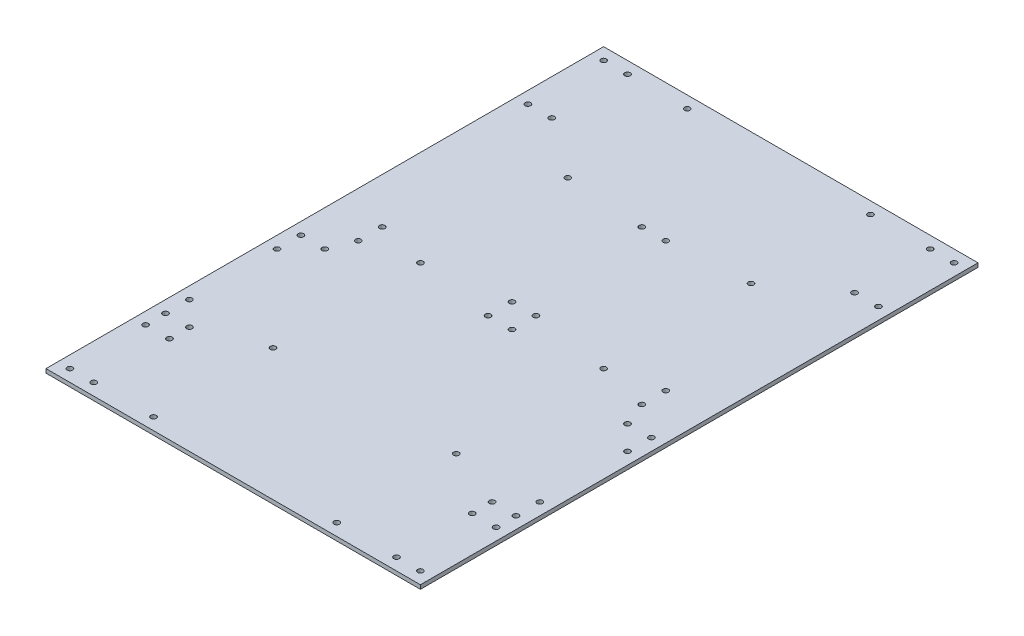
from build123d import *

# Parameters (mm, degrees)
SKETCH1_W           = 596.9
SKETCH1_H           = 889
SKETCH1_R           = 4.365625
BOSS_EXTRUDE1_DEPTH = 6.35


with BuildPart() as part:
    # Sketch1 → Boss-Extrude1 (new body)
    with BuildSketch(Plane(origin=(0, 0, 0), x_dir=(1, 0, 0), z_dir=(0, 1, 0))):
        with Locations((298.45, 514.143037509)):
            Rectangle(SKETCH1_W, SKETCH1_H)
        with Locations(Location((19.05, 939.593037509, 0), (0, 0, 270))):
            Circle(SKETCH1_R, mode=Mode.SUBTRACT)
        with Locations(Location((57.15, 939.593037509, 0), (0, 0, 270))):
            Circle(SKETCH1_R, mode=Mode.SUBTRACT)
        with Locations(Location((577.85, 939.593037509, 0), (0, 0, 90))):
            Circle(SKETCH1_R, mode=Mode.SUBTRACT)
        with Locations(Location((539.75, 939.593037509, 0), (0, 0, 90))):
            Circle(SKETCH1_R, mode=Mode.SUBTRACT)
        with Locations(Location((577.85, 88.693037509, 0), (0, 0, 270))):
            Circle(SKETCH1_R, mode=Mode.SUBTRACT)
        with Locations(Location((539.75, 88.693037509, 0), (0, 0, 270))):
            Circle(SKETCH1_R, mode=Mode.SUBTRACT)
        with Locations(Location((19.05, 88.693037509, 0), (0, 0, 90))):
            Circle(SKETCH1_R, mode=Mode.SUBTRACT)
        with Locations(Location((57.15, 88.693037509, 0), (0, 0, 90))):
            Circle(SKETCH1_R, mode=Mode.SUBTRACT)
        with Locations(Location((57.15, 209.343037509, 0), (0, 0, 270))):
            Circle(SKETCH1_R, mode=Mode.SUBTRACT)
        with Locations(Location((19.05, 209.343037509, 0), (0, 0, 270))):
            Circle(SKETCH1_R, mode=Mode.SUBTRACT)
        with Locations(Location((19.05, 818.943037509, 0), (0, 0, 90))):
            Circle(SKETCH1_R, mode=Mode.SUBTRACT)
        with Locations(Location((57.15, 818.943037509, 0), (0, 0, 90))):
            Circle(SKETCH1_R, mode=Mode.SUBTRACT)
        with Locations(Location((577.85, 209.343037509, 0), (0, 0, 90))):
            Circle(SKETCH1_R, mode=Mode.SUBTRACT)
        with Locations(Location((539.75, 209.343037509, 0), (0, 0, 90))):
            Circle(SKETCH1_R, mode=Mode.SUBTRACT)
        with Locations(Location((577.85, 818.943037509, 0), (0, 0, 270))):
            Circle(SKETCH1_R, mode=Mode.SUBTRACT)
        with Locations(Location((539.75, 818.943037509, 0), (0, 0, 270))):
            Circle(SKETCH1_R, mode=Mode.SUBTRACT)
        with Locations(Location((72.39, 533.193037509, 0), (0, 0, 270))):
            Circle(SKETCH1_R, mode=Mode.SUBTRACT)
        with Locations(Location((72.39, 495.093037509, 0), (0, 0, 270))):
            Circle(SKETCH1_R, mode=Mode.SUBTRACT)
        with Locations(Location((19.051421295, 456.993037509, 0), (0, 0, 270))):
            Circle(SKETCH1_R, mode=Mode.SUBTRACT)
        with Locations(Location((19.05, 241.093037509, 0), (0, 0, 270))):
            Circle(SKETCH1_R, mode=Mode.SUBTRACT)
        with Locations(Location((279.4, 495.093037509, 0), (0, 0, 270))):
            Circle(SKETCH1_R, mode=Mode.SUBTRACT)
        with Locations(Location((279.4, 533.193037509, 0), (0, 0, 270))):
            Circle(SKETCH1_R, mode=Mode.SUBTRACT)
        with Locations(Location((279.399999999, 740.203037509, 0), (0, 0, 270))):
            Circle(SKETCH1_R, mode=Mode.SUBTRACT)
        with Locations(Location((152.4, 939.593037509, 0), (0, 0, 270))):
            Circle(SKETCH1_R, mode=Mode.SUBTRACT)
        with Locations(Location((152.4, 514.143037509, 0), (0, 0, 270))):
            Circle(SKETCH1_R, mode=Mode.SUBTRACT)
        with Locations(Location((152.4, 749.093037509, 0), (0, 0, 270))):
            Circle(SKETCH1_R, mode=Mode.SUBTRACT)
        with Locations(Location((152.4, 279.193037509, 0), (0, 0, 90))):
            Circle(SKETCH1_R, mode=Mode.SUBTRACT)
        with Locations(Location((152.4, 88.693037509, 0), (0, 0, 90))):
            Circle(SKETCH1_R, mode=Mode.SUBTRACT)
        with Locations(Location((444.5, 88.693037509, 0), (0, 0, 270))):
            Circle(SKETCH1_R, mode=Mode.SUBTRACT)
        with Locations(Location((444.5, 279.193037509, 0), (0, 0, 270))):
            Circle(SKETCH1_R, mode=Mode.SUBTRACT)
        with Locations(Location((317.5, 533.193037509, 0), (0, 0, 90))):
            Circle(SKETCH1_R, mode=Mode.SUBTRACT)
        with Locations(Location((317.5, 495.093037509, 0), (0, 0, 90))):
            Circle(SKETCH1_R, mode=Mode.SUBTRACT)
        with Locations(Location((577.85, 241.093037509, 0), (0, 0, 90))):
            Circle(SKETCH1_R, mode=Mode.SUBTRACT)
        with Locations(Location((577.848578705, 456.993037509, 0), (0, 0, 90))):
            Circle(SKETCH1_R, mode=Mode.SUBTRACT)
        with Locations(Location((524.51, 495.093037509, 0), (0, 0, 90))):
            Circle(SKETCH1_R, mode=Mode.SUBTRACT)
        with Locations(Location((524.51, 533.193037509, 0), (0, 0, 90))):
            Circle(SKETCH1_R, mode=Mode.SUBTRACT)
        with Locations(Location((444.5, 514.143037509, 0), (0, 0, 90))):
            Circle(SKETCH1_R, mode=Mode.SUBTRACT)
        with Locations(Location((317.500000001, 740.203037509, 0), (0, 0, 90))):
            Circle(SKETCH1_R, mode=Mode.SUBTRACT)
        with Locations(Location((444.5, 749.093037509, 0), (0, 0, 90))):
            Circle(SKETCH1_R, mode=Mode.SUBTRACT)
        with Locations(Location((444.5, 939.593037509, 0), (0, 0, 90))):
            Circle(SKETCH1_R, mode=Mode.SUBTRACT)
        with Locations(Location((19.05, 279.193037509, 0), (0, 0, 270))):
            Circle(SKETCH1_R, mode=Mode.SUBTRACT)
        with Locations(Location((57.15, 241.093037509, 0), (0, 0, 270))):
            Circle(SKETCH1_R, mode=Mode.SUBTRACT)
        with Locations(Location((577.85, 279.193037509, 0), (0, 0, 90))):
            Circle(SKETCH1_R, mode=Mode.SUBTRACT)
        with Locations(Location((539.75, 241.093037509, 0), (0, 0, 90))):
            Circle(SKETCH1_R, mode=Mode.SUBTRACT)
        with Locations(Location((19.051421295, 418.893037509, 0), (0, 0, 270))):
            Circle(SKETCH1_R, mode=Mode.SUBTRACT)
        with Locations(Location((57.151421295, 456.993037509, 0), (0, 0, 270))):
            Circle(SKETCH1_R, mode=Mode.SUBTRACT)
        with Locations(Location((577.848578705, 418.893037509, 0), (0, 0, 90))):
            Circle(SKETCH1_R, mode=Mode.SUBTRACT)
        with Locations(Location((539.748578705, 456.993037509, 0), (0, 0, 90))):
            Circle(SKETCH1_R, mode=Mode.SUBTRACT)
    extrude(amount=BOSS_EXTRUDE1_DEPTH)


solid = part.part
